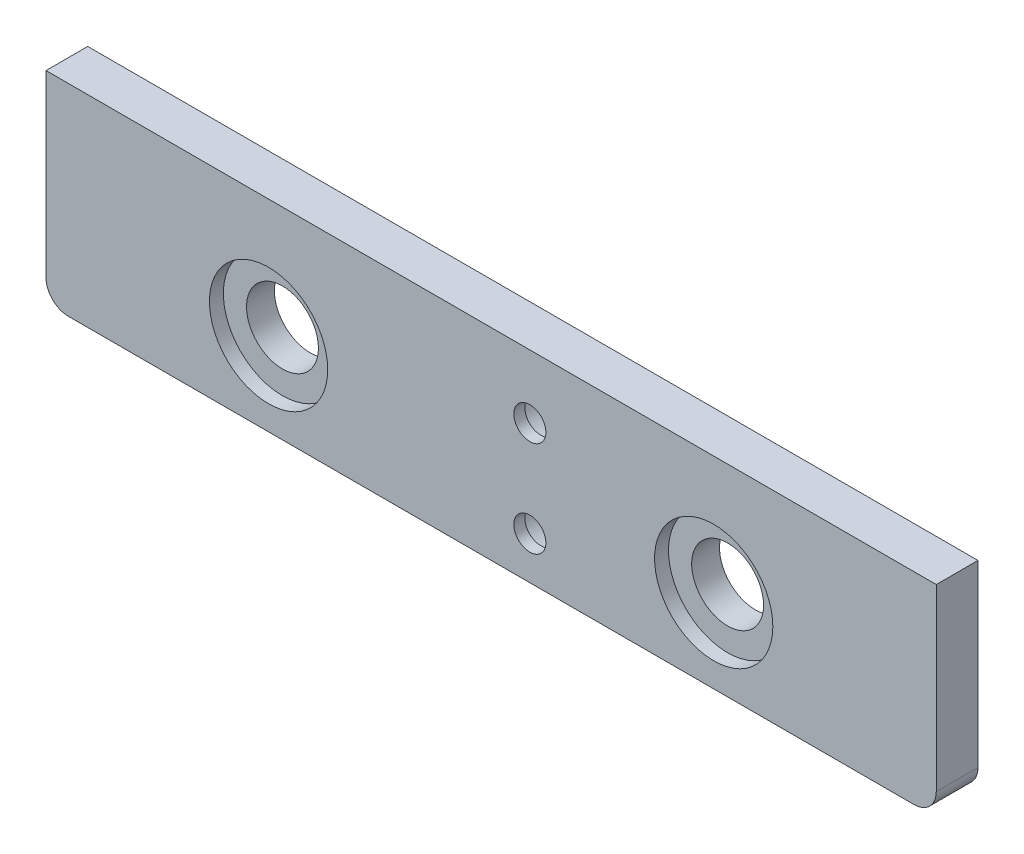
from build123d import *

# Parameters (mm, degrees)
SKETCH1_W                                         = 101.6
SKETCH1_H                                         = 23.0124
BOSS_EXTRUDE1_DEPTH                               = 4.7625
CBORE_FOR_5_16_SOCKET_HEAD_CAP_SCREW1_D           = 8.2042
CBORE_FOR_5_16_SOCKET_HEAD_CAP_SCREW1_CBORE_D     = 13.49502
CBORE_FOR_5_16_SOCKET_HEAD_CAP_SCREW1_CBORE_DEPTH = 1.5875
CBORE_FOR_6_SOCKET_HEAD_CAP_SCREW1_D              = 3.6576
CBORE_FOR_6_SOCKET_HEAD_CAP_SCREW1_CBORE_D        = 7.14502
CBORE_FOR_6_SOCKET_HEAD_CAP_SCREW1_CBORE_DEPTH    = 3.5052
FILLET1_R                                         = 2.54


with BuildPart() as part:
    # Sketch1 → Boss-Extrude1 (new body)
    with BuildSketch(Plane.XY):
        with Locations((50.8, 11.5062)):
            Rectangle(SKETCH1_W, SKETCH1_H)
    extrude(amount=BOSS_EXTRUDE1_DEPTH)

    # CBORE for 5/16 Socket Head Cap Screw1 (through all)
    with Locations(Plane.XY.offset(4.7625)):
        with Locations((76.2, 9.525), (25.4, 9.525)):
            CounterBoreHole(CBORE_FOR_5_16_SOCKET_HEAD_CAP_SCREW1_D / 2, CBORE_FOR_5_16_SOCKET_HEAD_CAP_SCREW1_CBORE_D / 2, CBORE_FOR_5_16_SOCKET_HEAD_CAP_SCREW1_CBORE_DEPTH)

    # CBORE for #6 Socket Head Cap Screw1 (through all)
    with Locations(Plane(origin=(0, 0, 0), x_dir=(-1, 0, 0), z_dir=(0, 0, -1))):
        with Locations((-55.218690757, 15.7734), (-55.218690757, 4.8514)):
            CounterBoreHole(CBORE_FOR_6_SOCKET_HEAD_CAP_SCREW1_D / 2, CBORE_FOR_6_SOCKET_HEAD_CAP_SCREW1_CBORE_D / 2, CBORE_FOR_6_SOCKET_HEAD_CAP_SCREW1_CBORE_DEPTH)

    # Fillet1
    fillet1_edges = [part.edges().sort_by_distance(p)[0] for p in [
        (101.6, 0, 2.38125),
        (0, 0, 2.38125),
    ]]
    fillet(fillet1_edges, radius=FILLET1_R)


solid = part.part
